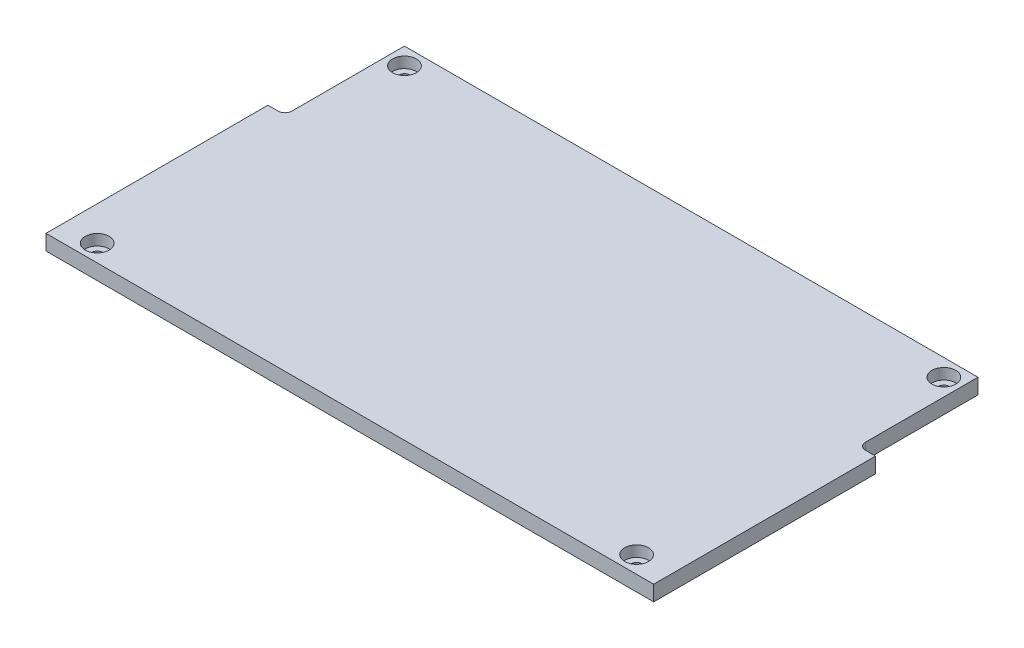
from build123d import *

# Parameters (mm, degrees)
SKIZZE1_W                                            = 89
SKIZZE1_H                                            = 50
AUFSATZ_LINEAR_AUSTRAGEN1_DEPTH                      = 4.5
SKIZZE3_W                                            = 16
SKIZZE3_H                                            = 12
SCHNITT_LINEAR_AUSTRAGEN2_DEPTH                      = 103.18243489
VERRUNDUNG1_R                                        = 2
LINEARES_MUSTER1_COUNT                               = 3
LINEARES_MUSTER1_PITCH                               = 16
LINEARES_MUSTER1_COUNT_DIR2                          = 4
LINEARES_MUSTER1_PITCH_DIR2                          = 20
VERRUNDUNG1_OF_LINEARES_MUSTER1_R                    = 2
SKIZZE2_R                                            = 5
AUFSATZ_LINEAR_AUSTRAGEN2_DEPTH                      = 4.5
STIRNSENKUNG_F_R_M3_FLACHKOPFSCHRAUBE_MI_D           = 3.4
STIRNSENKUNG_F_R_M3_FLACHKOPFSCHRAUBE_MI_CBORE_D     = 7
STIRNSENKUNG_F_R_M3_FLACHKOPFSCHRAUBE_MI_CBORE_DEPTH = 3.2
VERRUNDUNG3_R                                        = 3
SCHNITT_LINEAR_AUSTRAGEN3_DEPTH                      = 1.5
AUFSATZ_LINEAR_START                                 = -3
AUFSATZ_LINEAR_AUSTRAGEN3_DEPTH                      = 3
SKIZZE8_W                                            = 10
SKIZZE8_H                                            = 35
SCHNITT_LINEAR_AUSTRAGEN4_DEPTH                      = 103.18243489
VERRUNDUNG4_R                                        = 2


with BuildPart() as part:
    # Skizze1 → Aufsatz-Linear austragen1 (new body)
    with BuildSketch(Plane(origin=(0, 0, 0), x_dir=(1, 0, 0), z_dir=(0, 1, 0))):
        with Locations((-44.5, 25)):
            Rectangle(SKIZZE1_W, SKIZZE1_H)
    extrude(amount=AUFSATZ_LINEAR_AUSTRAGEN1_DEPTH)

    # Skizze3 → Schnitt-Linear austragen2 (cut, through all)
    with BuildSketch(Plane(origin=(0, 4.5, 0), x_dir=(1, 0, 0), z_dir=(0, 1, 0))):
        with Locations((-11, 9)):
            Rectangle(SKIZZE3_W, SKIZZE3_H)
    schnitt_linear_austragen2 = extrude(amount=-SCHNITT_LINEAR_AUSTRAGEN2_DEPTH, mode=Mode.SUBTRACT)

    # Verrundung1
    verrundung1_edges = [part.edges().sort_by_distance(p)[0] for p in [
        (-3, 2.25, -15),
        (-3, 2.25, -3),
        (-19, 2.25, -3),
        (-19, 2.25, -15),
    ]]
    fillet(verrundung1_edges, radius=VERRUNDUNG1_R)

    # Lineares Muster1: Schnitt-Linear austragen2 3 × 4
    with Locations(*[(-j * LINEARES_MUSTER1_PITCH_DIR2, 0, -i * LINEARES_MUSTER1_PITCH) for i in range(LINEARES_MUSTER1_COUNT) for j in range(LINEARES_MUSTER1_COUNT_DIR2) if (i, j) != (0, 0)]):
        add(schnitt_linear_austragen2, mode=Mode.SUBTRACT)

    # Verrundung1 of Lineares Muster1
    verrundung1_of_lineares_muster1_edges = [part.edges().sort_by_distance(p)[0] for p in [
        (-23, 2.25, -15),
        (-23, 2.25, -3),
        (-39, 2.25, -3),
        (-39, 2.25, -15),
        (-43, 2.25, -15),
        (-43, 2.25, -3),
        (-59, 2.25, -3),
        (-59, 2.25, -15),
        (-63, 2.25, -15),
        (-63, 2.25, -3),
        (-79, 2.25, -3),
        (-79, 2.25, -15),
        (-3, 2.25, -31),
        (-3, 2.25, -19),
        (-19, 2.25, -19),
        (-19, 2.25, -31),
        (-23, 2.25, -31),
        (-23, 2.25, -19),
        (-39, 2.25, -19),
        (-39, 2.25, -31),
        (-43, 2.25, -31),
        (-43, 2.25, -19),
        (-59, 2.25, -19),
        (-59, 2.25, -31),
        (-63, 2.25, -31),
        (-63, 2.25, -19),
        (-79, 2.25, -19),
        (-79, 2.25, -31),
        (-3, 2.25, -47),
        (-3, 2.25, -35),
        (-19, 2.25, -35),
        (-19, 2.25, -47),
        (-23, 2.25, -47),
        (-23, 2.25, -35),
        (-39, 2.25, -35),
        (-39, 2.25, -47),
        (-43, 2.25, -47),
        (-43, 2.25, -35),
        (-59, 2.25, -35),
        (-59, 2.25, -47),
        (-63, 2.25, -47),
        (-63, 2.25, -35),
        (-79, 2.25, -35),
        (-79, 2.25, -47),
    ]]
    fillet(verrundung1_of_lineares_muster1_edges, radius=VERRUNDUNG1_OF_LINEARES_MUSTER1_R)

    # Skizze2 → Aufsatz-Linear austragen2 (add)
    with BuildSketch(Plane(origin=(0, 4.5, 0), x_dir=(1, 0, 0), z_dir=(0, 1, 0))):
        with Locations((-79, 45)):
            Circle(SKIZZE2_R)
    extrude(amount=-AUFSATZ_LINEAR_AUSTRAGEN2_DEPTH)

    # Stirnsenkung für M3 Flachkopfschraube mit Schlitz1 (through all)
    with Locations(Plane(origin=(0, 4.5, 0), x_dir=(1, 0, 0), z_dir=(0, 1, 0))):
        with Locations((-79, 45)):
            CounterBoreHole(STIRNSENKUNG_F_R_M3_FLACHKOPFSCHRAUBE_MI_D / 2, STIRNSENKUNG_F_R_M3_FLACHKOPFSCHRAUBE_MI_CBORE_D / 2, STIRNSENKUNG_F_R_M3_FLACHKOPFSCHRAUBE_MI_CBORE_DEPTH)

    # Verrundung3
    verrundung3_edges = [part.edges().sort_by_distance(p)[0] for p in [
        (-74.417424305, 2.25, -47),
        (-79, 2.25, -40),
    ]]
    fillet(verrundung3_edges, radius=VERRUNDUNG3_R)

    # Skizze6 → Schnitt-Linear austragen3 (cut)
    with BuildSketch(Plane.XZ):
        Polygon((0, 0), (-79, 0), (-79, -37), (-71.062746067, -37), (-71.062746067, -47), (0, -47), align=None)
    extrude(amount=-SCHNITT_LINEAR_AUSTRAGEN3_DEPTH, mode=Mode.SUBTRACT)

    # Skizze7 → Aufsatz-Linear austragen3 (add)
    with BuildSketch(Plane.XZ.offset(-1.5).offset(AUFSATZ_LINEAR_START)):
        with BuildLine():
            Line((-79, 0), (0, 0))
            Line((0, 0), (0, -47))
            Line((0, -47), (-71.062746067, -47))
            ThreePointArc((-71.062746067, -47), (-73.04705955, -46.25), (-74.039216292, -44.375))
            ThreePointArc((-74.039216292, -44.375), (-75.037392467, -41.950780175), (-77.125, -40.364875946))
            ThreePointArc((-77.125, -40.364875946), (-78.487468593, -39.260852496), (-79, -37.583801513))
            Line((-79, -37.583801513), (-79, 0))
        make_face()
    extrude(amount=AUFSATZ_LINEAR_AUSTRAGEN3_DEPTH)

    # Spiegeln1: part across plane


with BuildPart() as part_1:
    add(part.part)
    add(part.part.mirror(Plane(origin=(0, 4.5, 0), x_dir=(1, 0, 0), z_dir=(0, 0, -1))))

    # Skizze8 → Schnitt-Linear austragen4 (cut, through all)
    with BuildSketch(Plane.XZ):
        with Locations((-89, -32.5)):
            Rectangle(SKIZZE8_W, SKIZZE8_H)
    extrude(amount=-SCHNITT_LINEAR_AUSTRAGEN4_DEPTH, mode=Mode.SUBTRACT)

    # Verrundung4
    verrundung4_edges = [part_1.edges().sort_by_distance(p)[0] for p in [
        (-84, 2.25, -15),
    ]]
    fillet(verrundung4_edges, radius=VERRUNDUNG4_R)

    # Spiegeln2: part across plane


with BuildPart() as part_2:
    add(part_1.part)
    add(part_1.part.mirror(Plane(origin=(0, 4.5, 0), x_dir=(0, 0, 1), z_dir=(-1, 0, 0))))


solid = part_2.part
